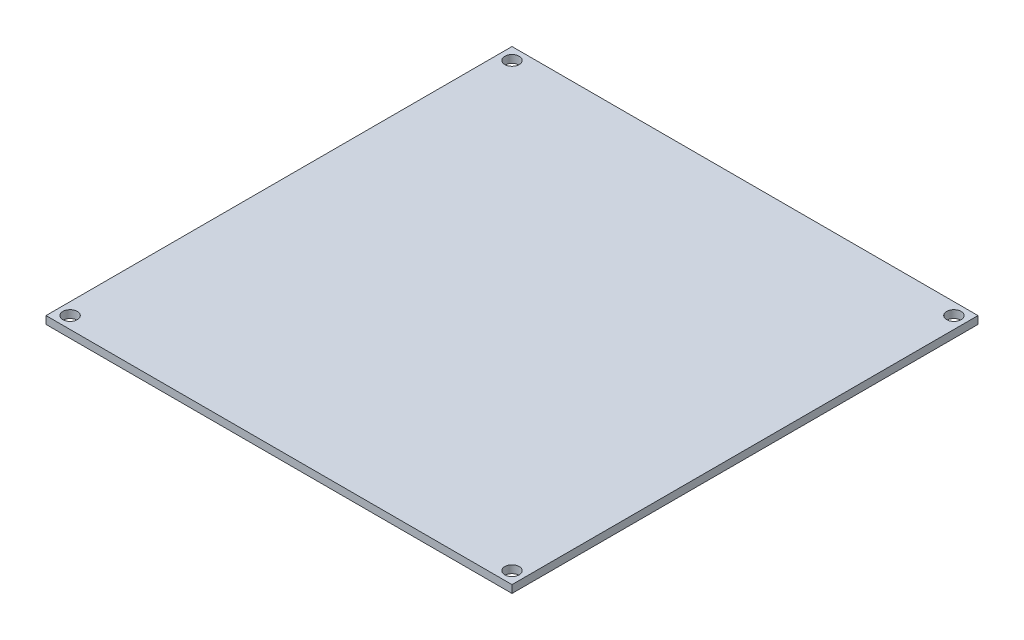
from build123d import *

# Parameters (mm, degrees)
SKETCH1_W           = 96.8
SKETCH1_H           = 96.8
SKETCH1_R           = 1.5
BOSS_EXTRUDE1_DEPTH = 1.6


with BuildPart() as part:
    # Sketch1 → Boss-Extrude1 (new body)
    with BuildSketch(Plane(origin=(0, 0, 0), x_dir=(1, 0, 0), z_dir=(0, 1, 0))):
        Rectangle(SKETCH1_W, SKETCH1_H)
        with Locations(Location((-45.9, 45.9, 0), (0, 0, 270))):
            Circle(SKETCH1_R, mode=Mode.SUBTRACT)
        with Locations(Location((-45.9, -45.9, 0), (0, 0, 90))):
            Circle(SKETCH1_R, mode=Mode.SUBTRACT)
        with Locations(Location((45.9, -45.9, 0), (0, 0, 270))):
            Circle(SKETCH1_R, mode=Mode.SUBTRACT)
        with Locations(Location((45.9, 45.9, 0), (0, 0, 90))):
            Circle(SKETCH1_R, mode=Mode.SUBTRACT)
    extrude(amount=BOSS_EXTRUDE1_DEPTH)


solid = part.part
